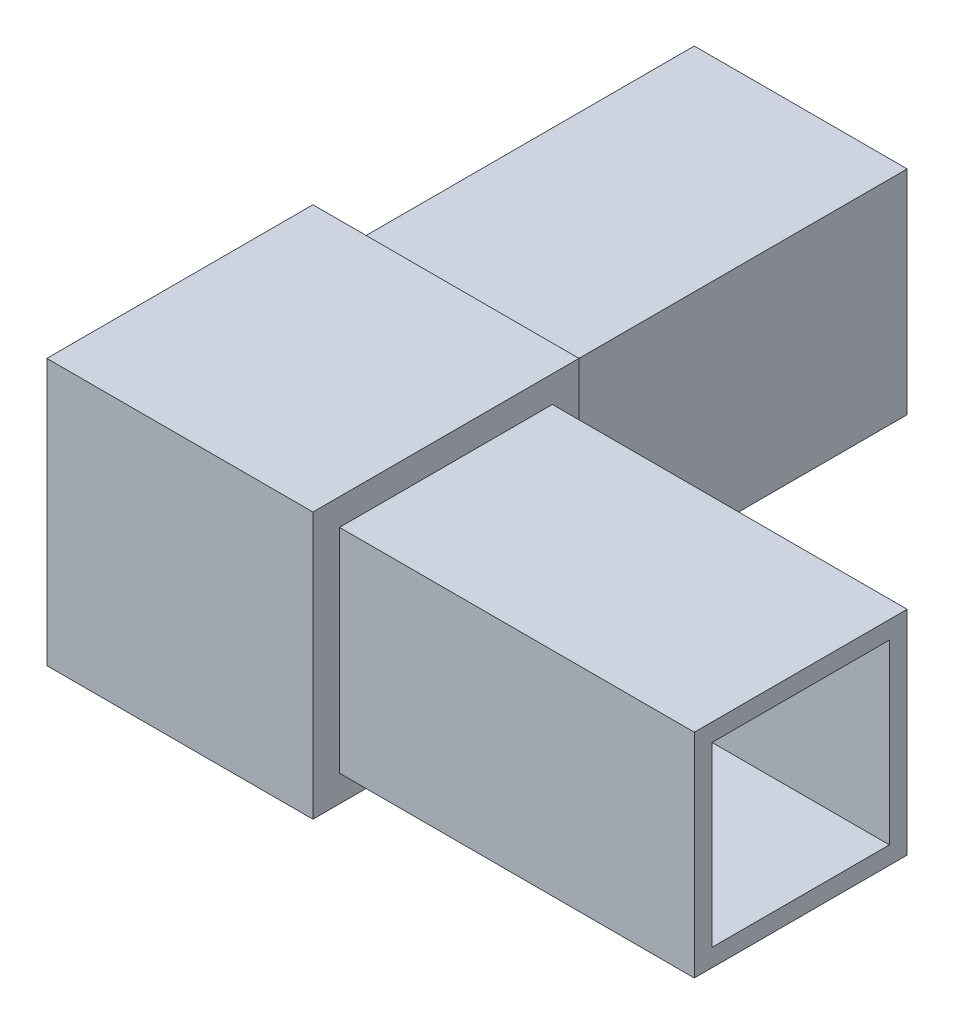
from build123d import *

# Parameters (mm, degrees)
CROQUIS1_W     = 30
CROQUIS1_H     = 40
CROQUIS1_H_2   = 30
CROQUIS1_W_2   = 40
EXTRUIR1_DEPTH = 30
CROQUIS2_W     = 30
CROQUIS2_H     = 30
CROQUIS2_W_2   = 24
CROQUIS2_H_2   = 24
EXTRUIR2_DEPTH = 40
CROQUIS3_W     = 30
CROQUIS3_H     = 30
CROQUIS3_W_2   = 24
CROQUIS3_H_2   = 24
EXTRUIR3_DEPTH = 40
VACIADO1_T     = -2


with BuildPart() as part:
    # Croquis1 → Extruir1 (new body)
    with BuildSketch(Plane(origin=(0, 0, 0), x_dir=(1, 0, 0), z_dir=(0, 1, 0))):
        with Locations((0, 35)):
            Rectangle(CROQUIS1_W, CROQUIS1_H)
        Rectangle(CROQUIS1_W, CROQUIS1_H_2)
        with Locations((35, 0)):
            Rectangle(CROQUIS1_W_2, CROQUIS1_H_2)
    extrude(amount=EXTRUIR1_DEPTH)

    # Croquis2 → Extruir2 (cut)
    with BuildSketch(Plane(origin=(55, 0, 0), x_dir=(0, 0, -1), z_dir=(1, 0, 0))):
        with Locations((0, 15)):
            Rectangle(CROQUIS2_W, CROQUIS2_H)
        with Locations((0, 15)):
            Rectangle(CROQUIS2_W_2, CROQUIS2_H_2, mode=Mode.SUBTRACT)
    extrude(amount=-EXTRUIR2_DEPTH, mode=Mode.SUBTRACT)

    # Croquis3 → Extruir3 (cut)
    with BuildSketch(Plane(origin=(0, 0, -55), x_dir=(-1, 0, 0), z_dir=(0, 0, -1))):
        with Locations((0, 15)):
            Rectangle(CROQUIS3_W, CROQUIS3_H)
        with Locations((0, 15)):
            Rectangle(CROQUIS3_W_2, CROQUIS3_H_2, mode=Mode.SUBTRACT)
    extrude(amount=-EXTRUIR3_DEPTH, mode=Mode.SUBTRACT)

    # Vaciado1
    vaciado1_openings = [part.faces().sort_by_distance(p)[0] for p in [
        (55, 15, 0),
        (0, 15, -55),
    ]]
    offset(amount=VACIADO1_T, openings=vaciado1_openings, kind=Kind.INTERSECTION)


solid = part.part
